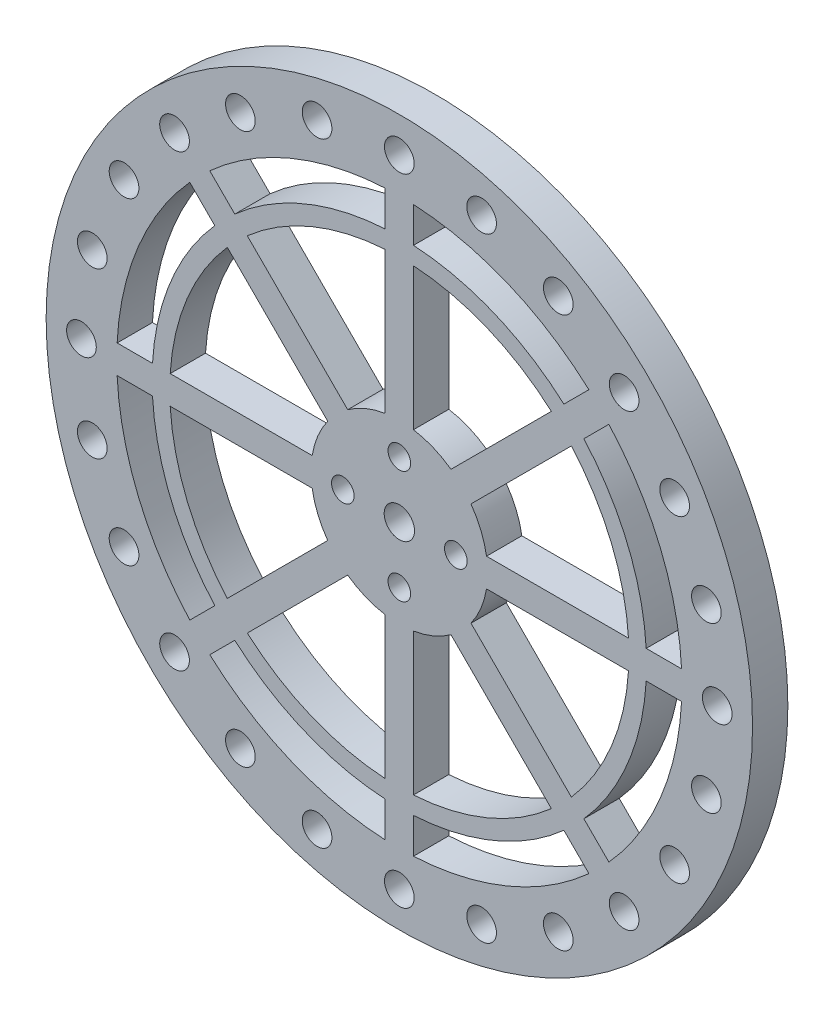
from build123d import *

# Parameters (mm, degrees)
SKETCH1_R           = 50
EXTRUDE2_DEPTH      = 2.5
EXTRUDE3_DEPTH      = 71.887234394
EXTRUDE3_DEPTH_BACK = 71.887234394
SKETCH2_R           = 2.1
EXTRUDE4_REACH      = 72.887
SKETCH3_R           = 1.6
SKETCH3_R_2         = 2.15


with BuildPart() as part:
    # Sketch1 → Extrude2 (new, symmetric)
    with BuildSketch(Plane.XY):
        Circle(SKETCH1_R)
        with BuildLine():
            Line((-2, 39.949968711), (-2, 34.942810419))
            ThreePointArc((-2, 34.942810419), (-13.393920133, 32.335783638), (-23.294084639, 26.122511764))
            Line((-23.294084639, 26.122511764), (-26.834680221, 29.663107346))
            ThreePointArc((-26.834680221, 29.663107346), (-15.307337295, 36.9551813), (-2, 39.949968711))
        make_face(mode=Mode.SUBTRACT)
        with BuildLine():
            Line((2, 34.942810419), (2, 39.949968711))
            ThreePointArc((2, 39.949968711), (15.307337295, 36.9551813), (26.834680221, 29.663107346))
            Line((26.834680221, 29.663107346), (23.294084639, 26.122511764))
            ThreePointArc((23.294084639, 26.122511764), (13.393920133, 32.335783638), (2, 34.942810419))
        make_face(mode=Mode.SUBTRACT)
        with BuildLine():
            Line((-29.663107346, 26.834680221), (-26.122511764, 23.294084639))
            ThreePointArc((-26.122511764, 23.294084639), (-32.335783638, 13.393920133), (-34.942810419, 2))
            Line((-34.942810419, 2), (-39.949968711, 2))
            ThreePointArc((-39.949968711, 2), (-36.9551813, 15.307337295), (-29.663107346, 26.834680221))
        make_face(mode=Mode.SUBTRACT)
        with BuildLine():
            Line((26.122511764, 23.294084639), (29.663107346, 26.834680221))
            ThreePointArc((29.663107346, 26.834680221), (36.9551813, 15.307337295), (39.949968711, 2))
            Line((39.949968711, 2), (34.942810419, 2))
            ThreePointArc((34.942810419, 2), (32.335783638, 13.393920133), (26.122511764, 23.294084639))
        make_face(mode=Mode.SUBTRACT)
        with BuildLine():
            Line((-39.949968711, -2), (-34.942810419, -2))
            ThreePointArc((-34.942810419, -2), (-32.335783638, -13.393920133), (-26.122511764, -23.294084639))
            Line((-26.122511764, -23.294084639), (-29.663107346, -26.834680221))
            ThreePointArc((-29.663107346, -26.834680221), (-36.9551813, -15.307337295), (-39.949968711, -2))
        make_face(mode=Mode.SUBTRACT)
        with BuildLine():
            Line((34.942810419, -2), (39.949968711, -2))
            ThreePointArc((39.949968711, -2), (36.9551813, -15.307337295), (29.663107346, -26.834680221))
            Line((29.663107346, -26.834680221), (26.122511764, -23.294084639))
            ThreePointArc((26.122511764, -23.294084639), (32.335783638, -13.393920133), (34.942810419, -2))
        make_face(mode=Mode.SUBTRACT)
        with BuildLine():
            Line((-26.834680221, -29.663107346), (-23.294084639, -26.122511764))
            ThreePointArc((-23.294084639, -26.122511764), (-13.393920133, -32.335783638), (-2, -34.942810419))
            Line((-2, -34.942810419), (-2, -39.949968711))
            ThreePointArc((-2, -39.949968711), (-15.307337295, -36.9551813), (-26.834680221, -29.663107346))
        make_face(mode=Mode.SUBTRACT)
        with BuildLine():
            Line((23.294084639, -26.122511764), (26.834680221, -29.663107346))
            ThreePointArc((26.834680221, -29.663107346), (15.307337295, -36.9551813), (2, -39.949968711))
            Line((2, -39.949968711), (2, -34.942810419))
            ThreePointArc((2, -34.942810419), (13.393920133, -32.335783638), (23.294084639, -26.122511764))
        make_face(mode=Mode.SUBTRACT)
        with BuildLine():
            ThreePointArc((-7.310750621, -10.139177746), (-4.783542905, -11.548494156), (-2, -12.338962679))
            Line((-2, -12.338962679), (-2, -32.438403167))
            ThreePointArc((-2, -32.438403167), (-12.437211552, -30.026084807), (-21.523201288, -24.351628412))
            Line((-21.523201288, -24.351628412), (-7.310750621, -10.139177746))
        make_face(mode=Mode.SUBTRACT)
        with BuildLine():
            ThreePointArc((-12.338962679, -2), (-11.548494156, -4.783542905), (-10.139177746, -7.310750621))
            Line((-10.139177746, -7.310750621), (-24.351628412, -21.523201288))
            ThreePointArc((-24.351628412, -21.523201288), (-30.026084807, -12.437211552), (-32.438403167, -2))
            Line((-32.438403167, -2), (-12.338962679, -2))
        make_face(mode=Mode.SUBTRACT)
        with BuildLine():
            ThreePointArc((21.523201288, -24.351628412), (12.437211552, -30.026084807), (2, -32.438403167))
            Line((2, -32.438403167), (2, -12.338962679))
            ThreePointArc((2, -12.338962679), (4.783542905, -11.548494156), (7.310750621, -10.139177746))
            Line((7.310750621, -10.139177746), (21.523201288, -24.351628412))
        make_face(mode=Mode.SUBTRACT)
        with BuildLine():
            ThreePointArc((32.438403167, -2), (30.026084807, -12.437211552), (24.351628412, -21.523201288))
            Line((24.351628412, -21.523201288), (10.139177746, -7.310750621))
            ThreePointArc((10.139177746, -7.310750621), (11.548494156, -4.783542905), (12.338962679, -2))
            Line((12.338962679, -2), (32.438403167, -2))
        make_face(mode=Mode.SUBTRACT)
        with BuildLine():
            ThreePointArc((-10.139177746, 7.310750621), (-11.548494156, 4.783542905), (-12.338962679, 2))
            Line((-12.338962679, 2), (-32.438403167, 2))
            ThreePointArc((-32.438403167, 2), (-30.026084807, 12.437211552), (-24.351628412, 21.523201288))
            Line((-24.351628412, 21.523201288), (-10.139177746, 7.310750621))
        make_face(mode=Mode.SUBTRACT)
        with BuildLine():
            ThreePointArc((-2, 12.338962679), (-4.783542905, 11.548494156), (-7.310750621, 10.139177746))
            Line((-7.310750621, 10.139177746), (-21.523201288, 24.351628412))
            ThreePointArc((-21.523201288, 24.351628412), (-12.437211552, 30.026084807), (-2, 32.438403167))
            Line((-2, 32.438403167), (-2, 12.338962679))
        make_face(mode=Mode.SUBTRACT)
        with BuildLine():
            ThreePointArc((24.351628412, 21.523201288), (30.026084807, 12.437211552), (32.438403167, 2))
            Line((32.438403167, 2), (12.338962679, 2))
            ThreePointArc((12.338962679, 2), (11.548494156, 4.783542905), (10.139177746, 7.310750621))
            Line((10.139177746, 7.310750621), (24.351628412, 21.523201288))
        make_face(mode=Mode.SUBTRACT)
        with BuildLine():
            ThreePointArc((2, 32.438403167), (12.437211552, 30.026084807), (21.523201288, 24.351628412))
            Line((21.523201288, 24.351628412), (7.310750621, 10.139177746))
            ThreePointArc((7.310750621, 10.139177746), (4.783542905, 11.548494156), (2, 12.338962679))
            Line((2, 12.338962679), (2, 32.438403167))
        make_face(mode=Mode.SUBTRACT)
    extrude(amount=EXTRUDE2_DEPTH, both=True)

    # Sketch2 → Extrude3 (cut, two sides: drawn at the far end of the back side and taken through both)
    with BuildSketch(Plane.XY.offset(2.5).offset(-EXTRUDE3_DEPTH_BACK)):
        with Locations((0, 45)):
            Circle(SKETCH2_R)
        with Locations((11.64685703, 43.466662183)):
            Circle(SKETCH2_R)
        with Locations((22.5, 38.97114317)):
            Circle(SKETCH2_R)
        with Locations((31.819805153, 31.819805153)):
            Circle(SKETCH2_R)
        with Locations((38.97114317, 22.5)):
            Circle(SKETCH2_R)
        with Locations((43.466662183, 11.64685703)):
            Circle(SKETCH2_R)
        with Locations((45, 0)):
            Circle(SKETCH2_R)
        with Locations((43.466662183, -11.64685703)):
            Circle(SKETCH2_R)
        with Locations((38.97114317, -22.5)):
            Circle(SKETCH2_R)
        with Locations((31.819805153, -31.819805153)):
            Circle(SKETCH2_R)
        with Locations((22.5, -38.97114317)):
            Circle(SKETCH2_R)
        with Locations((11.64685703, -43.466662183)):
            Circle(SKETCH2_R)
        with Locations((0, -45)):
            Circle(SKETCH2_R)
        with Locations((-11.64685703, -43.466662183)):
            Circle(SKETCH2_R)
        with Locations((-22.5, -38.97114317)):
            Circle(SKETCH2_R)
        with Locations((-31.819805153, -31.819805153)):
            Circle(SKETCH2_R)
        with Locations((-38.97114317, -22.5)):
            Circle(SKETCH2_R)
        with Locations((-43.466662183, -11.64685703)):
            Circle(SKETCH2_R)
        with Locations((-45, 0)):
            Circle(SKETCH2_R)
        with Locations((-43.466662183, 11.64685703)):
            Circle(SKETCH2_R)
        with Locations((-38.97114317, 22.5)):
            Circle(SKETCH2_R)
        with Locations((-31.819805153, 31.819805153)):
            Circle(SKETCH2_R)
        with Locations((-22.5, 38.97114317)):
            Circle(SKETCH2_R)
        with Locations((-11.64685703, 43.466662183)):
            Circle(SKETCH2_R)
    extrude(amount=EXTRUDE3_DEPTH + EXTRUDE3_DEPTH_BACK, mode=Mode.SUBTRACT)

    # Sketch3 → Extrude4 (cut, up to next)
    with BuildSketch(Plane.XY.offset(2.5), mode=Mode.PRIVATE) as extrude4_sk1:
        with Locations((0, 8)):
            Circle(SKETCH3_R)
    extrude4_tool1 = extrude(extrude4_sk1.sketch, amount=-EXTRUDE4_REACH, mode=Mode.PRIVATE) & part.part
    # Sketch3 → Extrude4 (cut, up to next)
    with BuildSketch(Plane.XY.offset(2.5), mode=Mode.PRIVATE) as extrude4_sk2:
        Circle(SKETCH3_R_2)
    extrude4_tool2 = extrude(extrude4_sk2.sketch, amount=-EXTRUDE4_REACH, mode=Mode.PRIVATE) & part.part
    # Sketch3 → Extrude4 (cut, up to next)
    with BuildSketch(Plane.XY.offset(2.5), mode=Mode.PRIVATE) as extrude4_sk3:
        with Locations((8, 0)):
            Circle(SKETCH3_R)
    extrude4_tool3 = extrude(extrude4_sk3.sketch, amount=-EXTRUDE4_REACH, mode=Mode.PRIVATE) & part.part
    # Sketch3 → Extrude4 (cut, up to next)
    with BuildSketch(Plane.XY.offset(2.5), mode=Mode.PRIVATE) as extrude4_sk4:
        with Locations((0, -8)):
            Circle(SKETCH3_R)
    extrude4_tool4 = extrude(extrude4_sk4.sketch, amount=-EXTRUDE4_REACH, mode=Mode.PRIVATE) & part.part
    # Sketch3 → Extrude4 (cut, up to next)
    with BuildSketch(Plane.XY.offset(2.5), mode=Mode.PRIVATE) as extrude4_sk5:
        with Locations((-8, 0)):
            Circle(SKETCH3_R)
    extrude4_tool5 = extrude(extrude4_sk5.sketch, amount=-EXTRUDE4_REACH, mode=Mode.PRIVATE) & part.part
    add(extrude4_tool1.solids().sort_by_distance((0, 8, 2.5))[0], mode=Mode.SUBTRACT)
    add(extrude4_tool2.solids().sort_by_distance((0, 0, 2.5))[0], mode=Mode.SUBTRACT)
    add(extrude4_tool3.solids().sort_by_distance((8, 0, 2.5))[0], mode=Mode.SUBTRACT)
    add(extrude4_tool4.solids().sort_by_distance((0, -8, 2.5))[0], mode=Mode.SUBTRACT)
    add(extrude4_tool5.solids().sort_by_distance((-8, 0, 2.5))[0], mode=Mode.SUBTRACT)


solid = part.part
